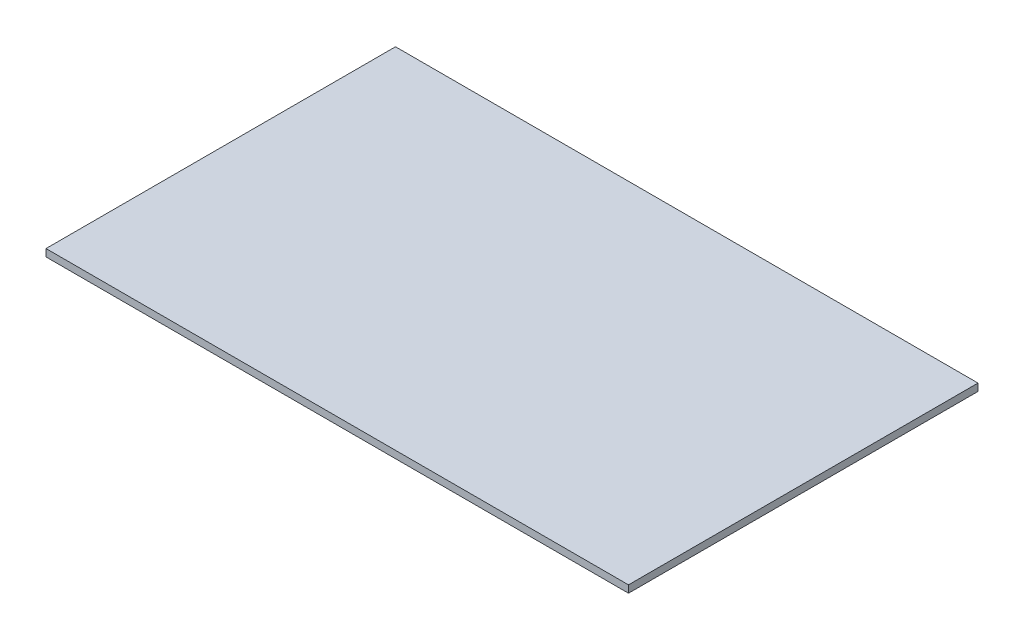
from build123d import *

# Parameters (mm, degrees)
SKETCH1_W           = 508
SKETCH1_H           = 304.8
BOSS_EXTRUDE1_DEPTH = 3.175


with BuildPart() as part:
    # Sketch1 → Boss-Extrude1 (new, symmetric)
    with BuildSketch(Plane(origin=(0, 0, 0), x_dir=(1, 0, 0), z_dir=(0, 1, 0))):
        Rectangle(SKETCH1_W, SKETCH1_H)
    extrude(amount=BOSS_EXTRUDE1_DEPTH, both=True)


solid = part.part
